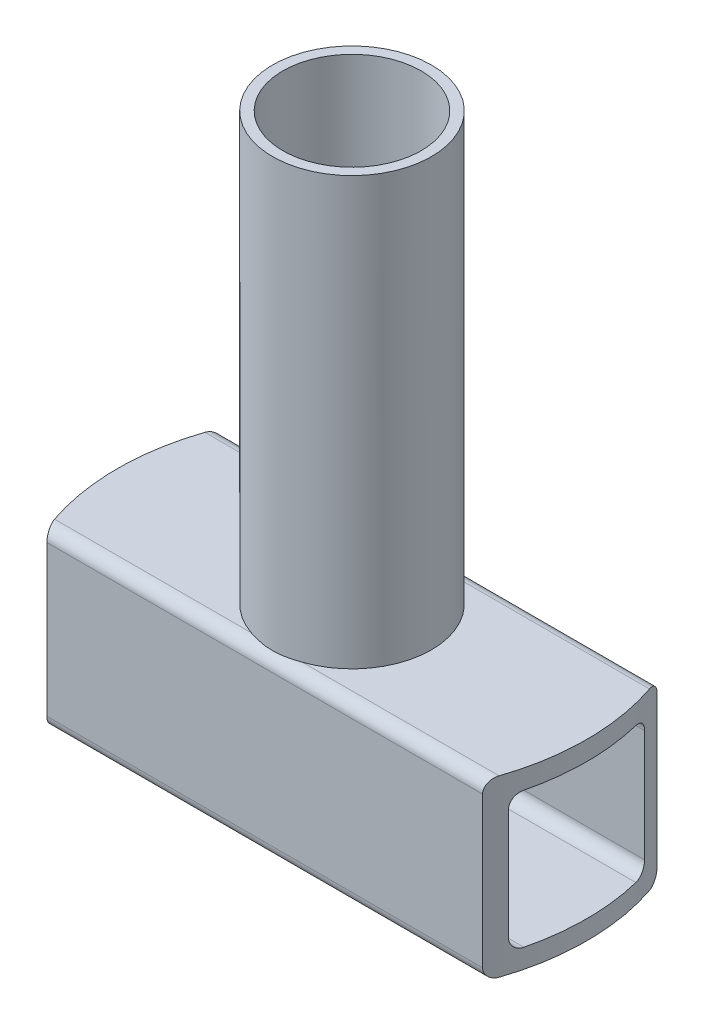
from build123d import *

# Parameters (mm, degrees)
SKETCH1_W           = 36.83
SKETCH1_H           = 36.83
SKETCH1_W_2         = 28.702
SKETCH1_H_2         = 28.702
BOSS_EXTRUDE1_DEPTH = 50.8
FILLET1_R           = 2.54
SKETCH3_R           = 16.764
CUT_EXTRUDE2_DEPTH  = 66.39266874
CUT_EXTRUDE3_DEPTH  = 66.392668903
BOSS_EXTRUDE2_START = -127
SKETCH5_R           = 16.764
SKETCH5_R_2         = 14.605
BOSS_EXTRUDE2_DEPTH = 127


with BuildPart() as part:
    # Sketch1 → Boss-Extrude1 (new, symmetric)
    with BuildSketch(Plane(origin=(0, 0, 0), x_dir=(0, 0, -1), z_dir=(1, 0, 0))):
        Rectangle(SKETCH1_W, SKETCH1_H)
        Rectangle(SKETCH1_W_2, SKETCH1_H_2, mode=Mode.SUBTRACT)
    extrude(amount=BOSS_EXTRUDE1_DEPTH, both=True)

    # Fillet1
    fillet1_edges = [part.edges().sort_by_distance(p)[0] for p in [
        (0, -14.351, -14.351),
        (0, 14.351, -14.351),
        (0, 14.351, 14.351),
        (0, -14.351, 14.351),
        (0, 18.415, 18.415),
        (0, 18.415, -18.415),
        (0, -18.415, -18.415),
        (0, -18.415, 18.415),
    ]]
    fillet(fillet1_edges, radius=FILLET1_R)

    # Sketch3 → Cut-Extrude2 (cut, through all)
    with BuildSketch(Plane(origin=(0, 18.415, 0), x_dir=(1, 0, 0), z_dir=(0, 1, 0))):
        with Locations(Location((0, 0, 0), (0, 0, 251.257054082))):
            Circle(SKETCH3_R)
    extrude(amount=-CUT_EXTRUDE2_DEPTH, mode=Mode.SUBTRACT)

    # Sketch4 → Cut-Extrude3 (cut, through all)
    with BuildSketch(Plane(origin=(0, 18.415, 0), x_dir=(1, 0, 0), z_dir=(0, 1, 0))):
        with BuildLine():
            Line((-45.979437524, 18.415), (-50.8, 18.415))
            Line((-50.8, 18.415), (-50.8, -18.415))
            Line((-50.8, -18.415), (-45.979437524, -18.415))
            ThreePointArc((-45.979437524, -18.415), (-49.53, 0), (-45.979437524, 18.415))
        make_face()
        with BuildLine():
            Line((50.8, 15.875), (46.917004114, 15.875))
            ThreePointArc((46.917004114, 15.875), (48.872385422, 8.044305012), (49.53, 0))
            ThreePointArc((49.53, 0), (48.872385422, -8.044305012), (46.917004114, -15.875))
            Line((46.917004114, -15.875), (50.8, -15.875))
            Line((50.8, -15.875), (50.8, 15.875))
        make_face()
        with BuildLine():
            Line((50.8, 18.415), (45.979437524, 18.415))
            ThreePointArc((45.979437524, 18.415), (46.465579919, 17.151407603), (46.917004114, 15.875))
            Line((46.917004114, 15.875), (50.8, 15.875))
            Line((50.8, 15.875), (50.8, 18.415))
        make_face()
        with BuildLine():
            ThreePointArc((46.917004114, -15.875), (46.465579919, -17.151407603), (45.979437524, -18.415))
            Line((45.979437524, -18.415), (50.8, -18.415))
            Line((50.8, -18.415), (50.8, -15.875))
            Line((50.8, -15.875), (46.917004114, -15.875))
        make_face()
    extrude(amount=-CUT_EXTRUDE3_DEPTH, mode=Mode.SUBTRACT)

    # Sketch5 → Boss-Extrude2 (add)
    with BuildSketch(Plane.XZ.offset(18.415).offset(BOSS_EXTRUDE2_START)):
        with Locations(Location((0, 0, 0), (0, 0, 270))):
            Circle(SKETCH5_R)
        with Locations(Location((0, 0, 0), (0, 0, 270))):
            Circle(SKETCH5_R_2, mode=Mode.SUBTRACT)
    extrude(amount=BOSS_EXTRUDE2_DEPTH)


solid = part.part
